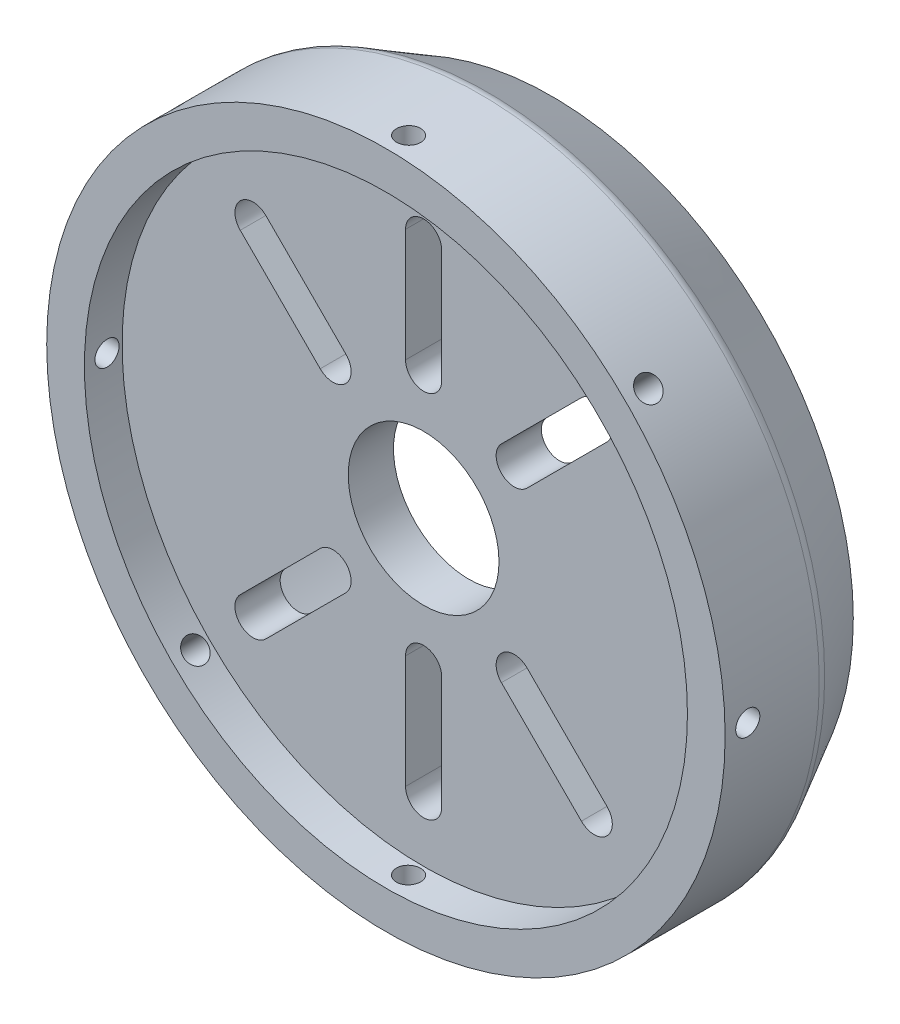
from build123d import *

# Parameters (mm, degrees)
CUT_EXTRUDE1_DEPTH = 84.656279501
CIRPATTERN1_COUNT  = 8
SKETCH3_R          = 2.032
CUT_EXTRUDE2_DEPTH = 84.656279501
CIRPATTERN2_COUNT  = 8
FILLET1_R          = 2.54


with BuildPart() as part:
    # Sketch1 → Revolve1 (revolve)
    with BuildSketch(Plane(origin=(0, 0, 0), x_dir=(0, 0, -1), z_dir=(1, 0, 0)), mode=Mode.PRIVATE) as revolve1_sk:
        Polygon((0, 12.7), (0, 50.8), (-6.35, 50.8), (-6.35, 57.15), (10.16, 57.15), (21.59, 50.8), (21.59, 45.72), (7.62, 45.72), (7.62, 12.7), align=None)
    revolve(revolve1_sk.sketch.rotate(Axis((0, 0, 0), (0, 0, -1)), 90), axis=Axis((0, 0, 0), (0, 0, -1)))

    # Sketch2 → Cut-Extrude1 (cut, through all)
    with BuildSketch(Plane.XY):
        with BuildLine():
            Line((-3.048, 21.59), (-3.048, 40.64))
            ThreePointArc((-3.048, 40.64), (0, 43.688), (3.048, 40.64))
            Line((3.048, 40.64), (3.048, 21.59))
            ThreePointArc((3.048, 21.59), (0, 18.542), (-3.048, 21.59))
        make_face()
    cut_extrude1 = extrude(amount=-CUT_EXTRUDE1_DEPTH, mode=Mode.SUBTRACT)

    # CirPattern1: Cut-Extrude1 ×8 about axis, 2 skipped
    cirpattern1_axis = Axis((0, 0, 0), (0, 0, -1))
    add([cut_extrude1.rotate(cirpattern1_axis, i * 360 / CIRPATTERN1_COUNT) for i in range(1, CIRPATTERN1_COUNT) if i not in (2, 6)], mode=Mode.SUBTRACT)

    # Sketch3 → Cut-Extrude2 (cut, through all)
    with BuildSketch(Plane(origin=(0, 0, 0), x_dir=(1, 0, 0), z_dir=(0, 1, 0))):
        with Locations(Location((0, -2.54, 0), (0, 0, 270))):
            Circle(SKETCH3_R)
    cut_extrude2 = extrude(amount=-CUT_EXTRUDE2_DEPTH, mode=Mode.SUBTRACT)

    # CirPattern2: Cut-Extrude2 ×8 about axis
    cirpattern2_axis = Axis((0, 0, 0), (0, 0, 1))
    for i in range(1, CIRPATTERN2_COUNT):
        add(cut_extrude2.rotate(cirpattern2_axis, i * 360 / CIRPATTERN2_COUNT), mode=Mode.SUBTRACT)

    # Fillet1
    fillet1_edges = [part.edges().sort_by_distance(p)[0] for p in [
        (-57.15, 0, -10.16),
    ]]
    fillet(fillet1_edges, radius=FILLET1_R)


solid = part.part
